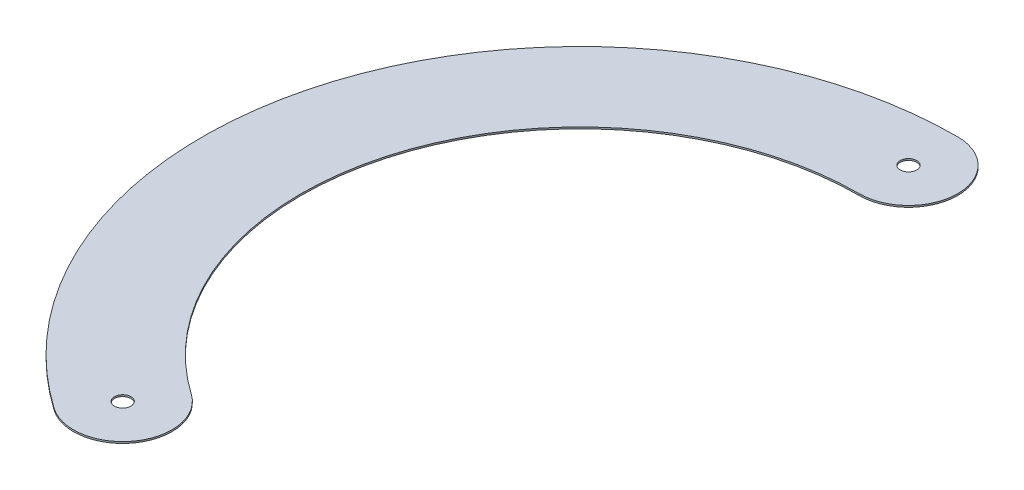
from build123d import *

# Parameters (mm, degrees)
SKETCH1_R           = 0.75
BOSS_EXTRUDE1_DEPTH = 0.15


with BuildPart() as part:
    # Sketch1 → Boss-Extrude1 (new body)
    with BuildSketch(Plane(origin=(0, 0, 0), x_dir=(1, 0, 0), z_dir=(0, 1, 0))):
        with BuildLine():
            ThreePointArc((0, 34.5), (-32.903234801, 10.374350083), (-19.788387054, -28.260745528))
            ThreePointArc((-19.788387054, -28.260745528), (-13.521108891, -27.155655292), (-14.626199127, -20.888377129))
            ThreePointArc((-14.626199127, -20.888377129), (-24.319782244, 7.667997887), (0, 25.5))
            ThreePointArc((0, 25.5), (4.5, 30), (0, 34.5))
        make_face()
        with Locations(Location((0, 30, 0), (0, 0, 270))):
            Circle(SKETCH1_R, mode=Mode.SUBTRACT)
        with Locations(Location((-17.207293091, -24.574561329, 0), (0, 0, 270))):
            Circle(SKETCH1_R, mode=Mode.SUBTRACT)
    extrude(amount=BOSS_EXTRUDE1_DEPTH)


solid = part.part
